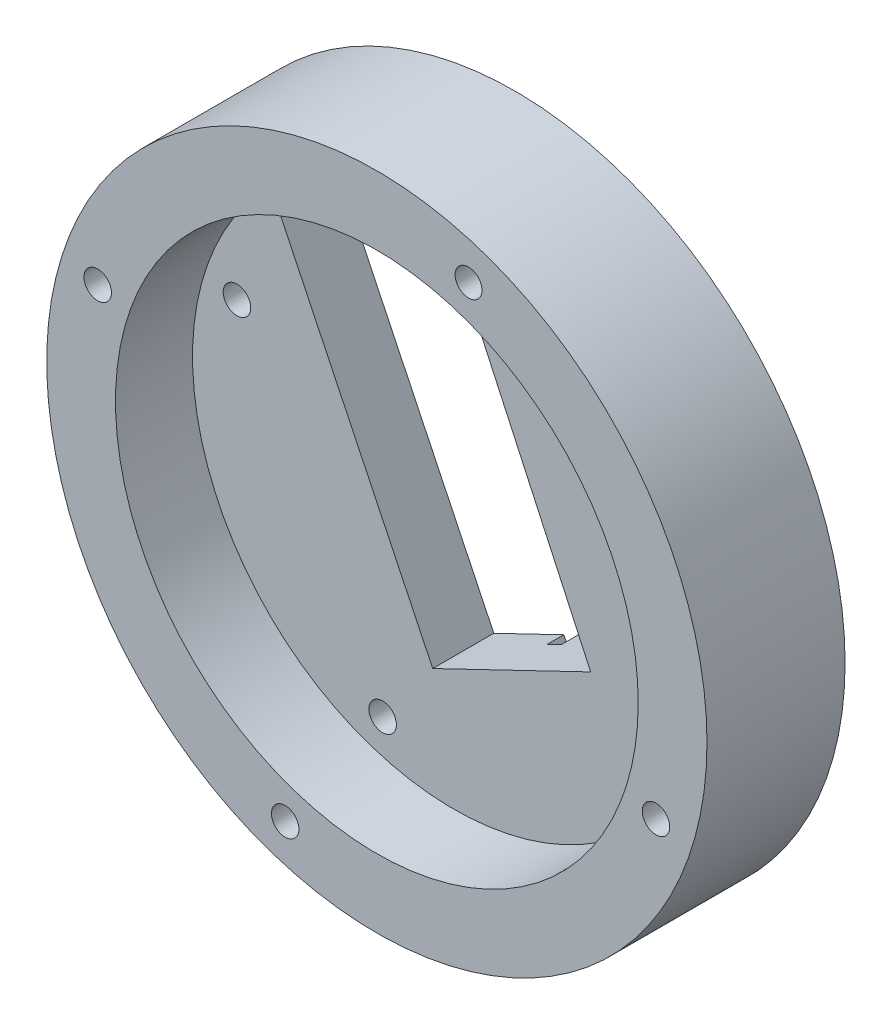
from build123d import *

# Parameters (mm, degrees)
SKETCH1_R               = 60
BOSS_EXTRUDE1_DEPTH     = 25.1
SKETCH3_R               = 47.5
CUT_EXTRUDE2_DEPTH      = 14
CUT_EXTRUDE5_DEPTH      = 89.487343728
CUT_EXTRUDE5_DEPTH_BACK = 89.487343728
SKETCH2_R               = 2.494998654
SKETCH2_R_2             = 2.5
SKETCH2_R_3             = 2.444443829
SKETCH6_R               = 3
CUT_EXTRUDE6_DEPTH      = 6
CUT_EXTRUDE7_DEPTH      = 87
CUT_EXTRUDE7_DEPTH_BACK = 87
SKETCH8_R               = 2.5
CUT_EXTRUDE8_DEPTH      = 81
CUT_EXTRUDE9_DEPTH      = 3


with BuildPart() as part:
    # Sketch1 → Boss-Extrude1 (new body)
    with BuildSketch(Plane.XY):
        Circle(SKETCH1_R)
    extrude(amount=BOSS_EXTRUDE1_DEPTH)

    # Sketch3 → Cut-Extrude2 (cut)
    with BuildSketch(Plane.XY.offset(25.1)):
        Circle(SKETCH3_R)
    extrude(amount=-CUT_EXTRUDE2_DEPTH, mode=Mode.SUBTRACT)

    # Sketch2 → Cut-Extrude5 (cut, two sides: drawn at the far end of the back side and taken through both)
    with BuildSketch(Plane.XY.offset(25.1).offset(-CUT_EXTRUDE5_DEPTH_BACK)):
        with Locations((-16.664697145, -50.733104448)):
            Circle(SKETCH2_R)
        with Locations((-50.733105114, 16.664696544)):
            Circle(SKETCH2_R_2)
        with Locations((16.664695878, 50.733104512)):
            Circle(SKETCH2_R_3)
        with Locations((50.733103846, -16.66469648)):
            Circle(SKETCH2_R_2)
    extrude(amount=CUT_EXTRUDE5_DEPTH + CUT_EXTRUDE5_DEPTH_BACK, mode=Mode.SUBTRACT)

    # Sketch6 → Cut-Extrude6 (cut)
    with BuildSketch(Plane(origin=(0, 0, 0), x_dir=(-1, 0, 0), z_dir=(0, 0, -1))):
        with Locations((11.973502988, 47.212610548)):
            Circle(SKETCH6_R)
        with Locations((27.381285989, 40.029281029)):
            Circle(SKETCH6_R)
        with Locations((-19.717656658, -20.762902692)):
            Circle(SKETCH6_R)
        with Locations((-4.309873657, -27.946232212)):
            Circle(SKETCH6_R)
    extrude(amount=-CUT_EXTRUDE6_DEPTH, mode=Mode.SUBTRACT)

    # Sketch7 → Cut-Extrude7 (cut, two sides: drawn at the far end of the back side and taken through both)
    with BuildSketch(Plane.XY.offset(11.1).offset(-CUT_EXTRUDE7_DEPTH_BACK)):
        Polygon((-32.722381774, 32.714358343), (-3.845549598, -27.273283804), (24.859322702, -13.455341469), (-3.0425496, 47.001626555), align=None)
    extrude(amount=CUT_EXTRUDE7_DEPTH + CUT_EXTRUDE7_DEPTH_BACK, mode=Mode.SUBTRACT)

    # Sketch8 → Cut-Extrude8 (cut)
    with BuildSketch(Plane(origin=(0, 0, 0), x_dir=(-1, 0, 0), z_dir=(0, 0, -1))):
        with Locations((-39.427412605, -12.951028347)):
            Circle(SKETCH8_R)
        with Locations((-12.951028347, 39.427412605)):
            Circle(SKETCH8_R)
        with Locations((39.427412605, 12.951028347)):
            Circle(SKETCH8_R)
        with Locations((12.951028347, -39.427412605)):
            Circle(SKETCH8_R)
    extrude(amount=-CUT_EXTRUDE8_DEPTH, mode=Mode.SUBTRACT)

    # Sketch9 → Cut-Extrude9 (cut)
    with BuildSketch(Plane(origin=(0, 0, 0), x_dir=(-1, 0, 0), z_dir=(0, 0, -1))):
        Polygon((-8.880375106, -21.147282201), (-11.884100541, -27.387108141), (-14.440828659, -26.156351169), (-11.437103225, -19.916525229), align=None)
        Polygon((19.284340571, 39.183158361), (22.354381036, 45.560744644), (19.657241196, 46.859092966), (16.587200731, 40.481506683), align=None)
    extrude(amount=-CUT_EXTRUDE9_DEPTH, mode=Mode.SUBTRACT)


solid = part.part
